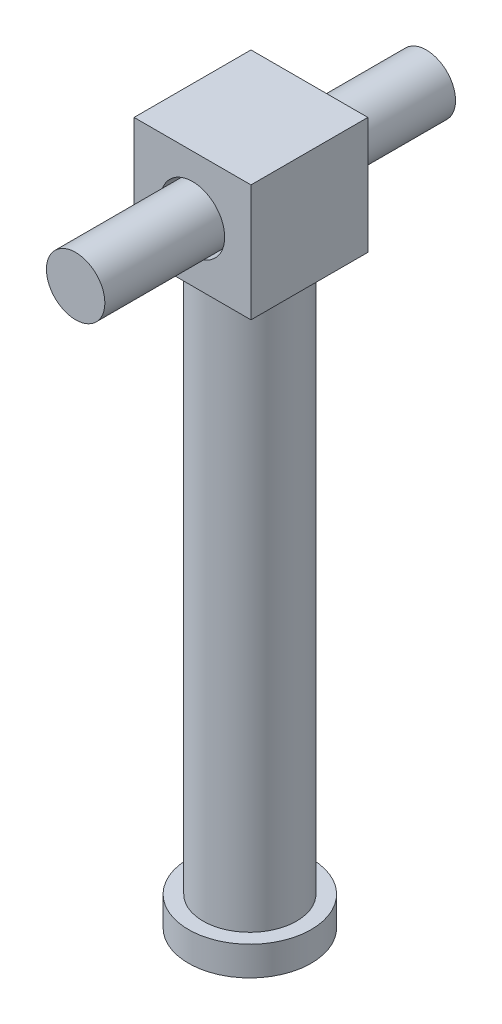
from build123d import *

# Parameters (mm, degrees)
SKETCH1_R                = 16
BOSS_EXTRUDE1_DEPTH      = 100
SKETCH2_W                = 40
SKETCH2_H                = 40
BOSS_EXTRUDE2_DEPTH      = 40
BOSS_EXTRUDE3_DEPTH      = 40
BOSS_EXTRUDE3_DEPTH_BACK = 80
SKETCH3_R                = 10
BOSS_EXTRUDE4_START      = 100
SKETCH4_R                = 16
BOSS_EXTRUDE4_DEPTH      = 100
SKETCH5_R                = 21
SKETCH5_R_2              = 16
BOSS_EXTRUDE5_DEPTH      = 10
SKETCH6_R                = 11
SKETCH6_R_2              = 10
CUT_EXTRUDE1_DEPTH       = 100


with BuildPart() as part:
    # Sketch1 → Boss-Extrude1 (new body)
    with BuildSketch(Plane(origin=(0, 0, 0), x_dir=(1, 0, 0), z_dir=(0, 1, 0))):
        with Locations(Location((0, -0.388679949, 0), (0, 0, 90))):
            Circle(SKETCH1_R)
    extrude(amount=BOSS_EXTRUDE1_DEPTH)

    # Sketch2 → Boss-Extrude2 (add)
    with BuildSketch(Plane(origin=(0, 100, 0), x_dir=(1, 0, 0), z_dir=(0, 1, 0))):
        Rectangle(SKETCH2_W, SKETCH2_H)
    extrude(amount=BOSS_EXTRUDE2_DEPTH)

    # Sketch3 → Boss-Extrude3 (add, two sides: drawn at the far end of the back side and taken through both)
    with BuildSketch(Plane.XY.offset(20).offset(-BOSS_EXTRUDE3_DEPTH_BACK)):
        with Locations((0, 120)):
            Circle(SKETCH3_R)
    extrude(amount=BOSS_EXTRUDE3_DEPTH + BOSS_EXTRUDE3_DEPTH_BACK)

    # Sketch4 → Boss-Extrude4 (add)
    with BuildSketch(Plane.XZ.offset(BOSS_EXTRUDE4_START)):
        with Locations(Location((0, 0.388679949, 0), (0, 0, 270))):
            Circle(SKETCH4_R)
    extrude(amount=-BOSS_EXTRUDE4_DEPTH)

    # Sketch5 → Boss-Extrude5 (add)
    with BuildSketch(Plane.XZ.offset(100)):
        with Locations(Location((0, 0.388679949, 0), (0, 0, 270))):
            Circle(SKETCH5_R)
        with Locations(Location((0, 0.388679949, 0), (0, 0, 270))):
            Circle(SKETCH5_R_2, mode=Mode.SUBTRACT)
    extrude(amount=-BOSS_EXTRUDE5_DEPTH)

    # Sketch6 → Cut-Extrude1 (cut)
    with BuildSketch(Plane.XY.offset(60)):
        with Locations((0, 120)):
            Circle(SKETCH6_R)
        with Locations((0, 120)):
            Circle(SKETCH6_R_2, mode=Mode.SUBTRACT)
    extrude(amount=-CUT_EXTRUDE1_DEPTH, mode=Mode.SUBTRACT)


with BuildPart() as cut_extrude1_piece_1:
    # of the separate pieces the step leaves, piece 1, a body of its own (cut_extrude1_pieces)
    add(part.part.solids().sort_by_distance((-20, 100, 20))[0])


with BuildPart() as cut_extrude1_piece_2:
    # of the separate pieces the step leaves, piece 2, a body of its own (cut_extrude1_pieces)
    add(part.part.solids().sort_by_distance((10, 120, 60))[0])


solid = Compound([cut_extrude1_piece_1.part, cut_extrude1_piece_2.part])
